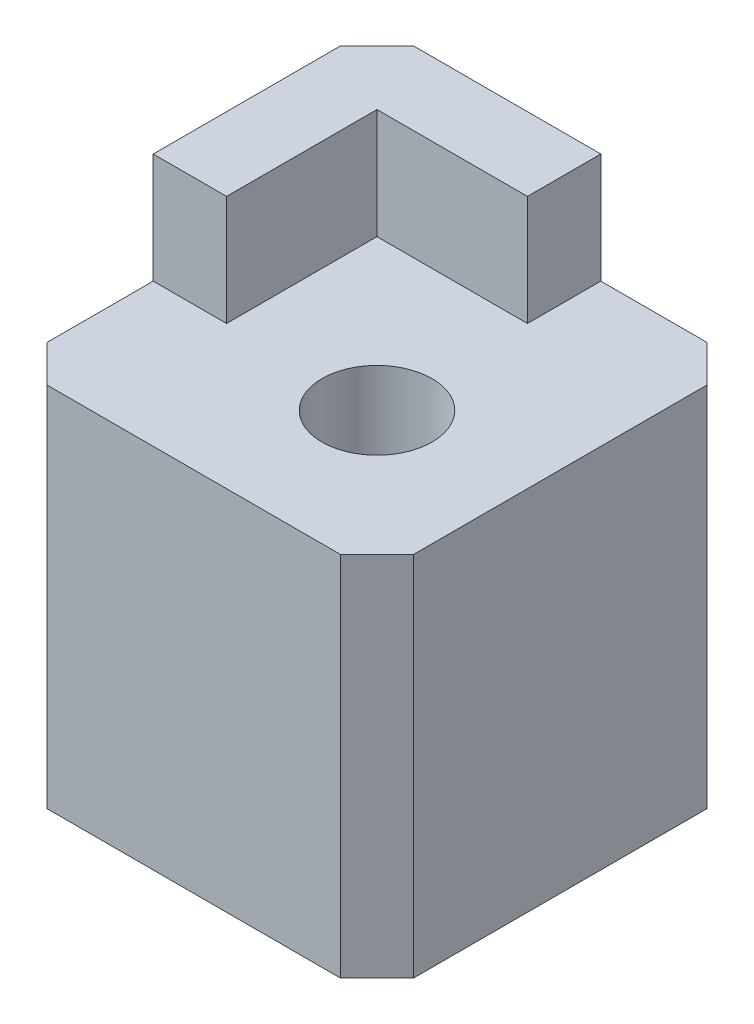
from build123d import *

# Parameters (mm, degrees)
SKETCH1_W           = 10
SKETCH1_H           = 10
BOSS_EXTRUDE1_DEPTH = 10
BOSS_EXTRUDE2_DEPTH = 3
CHAMFER1_SIZE       = 1
SKETCH1_4_R         = 1.5
CUT_EXTRUDE1_DEPTH  = 14.206816422


with BuildPart() as part:
    # Sketch1 → Boss-Extrude1 (new body)
    with BuildSketch(Plane(origin=(0, 0, 0), x_dir=(1, 0, 0), z_dir=(0, 1, 0))):
        with Locations((-1.1, 1.1)):
            Rectangle(SKETCH1_W, SKETCH1_H)
    extrude(amount=-BOSS_EXTRUDE1_DEPTH)

    # Sketch1<3> → Boss-Extrude2 (add)
    with BuildSketch(Plane(origin=(0, 0, 0), x_dir=(1, 0, 0), z_dir=(0, 1, 0))):
        Polygon((-4.1, 4.1), (0, 4.1), (0, 6.1), (-6.1, 6.1), (-6.1, 0), (-4.1, 0), align=None)
    extrude(amount=BOSS_EXTRUDE2_DEPTH)

    # Chamfer1
    chamfer1_edges = [part.edges().sort_by_distance(p)[0] for p in [
        (-6.1, -3.5, -6.1),
        (3.9, -5, -6.1),
        (-6.1, -5, 3.9),
        (3.9, -5, 3.9),
    ]]
    chamfer(chamfer1_edges, length=CHAMFER1_SIZE)

    # Sketch1<4> → Cut-Extrude1 (cut, through all)
    with BuildSketch(Plane(origin=(0, 0, 0), x_dir=(1, 0, 0), z_dir=(0, 1, 0))):
        Circle(SKETCH1_4_R)
    extrude(amount=-CUT_EXTRUDE1_DEPTH, mode=Mode.SUBTRACT)


solid = part.part
